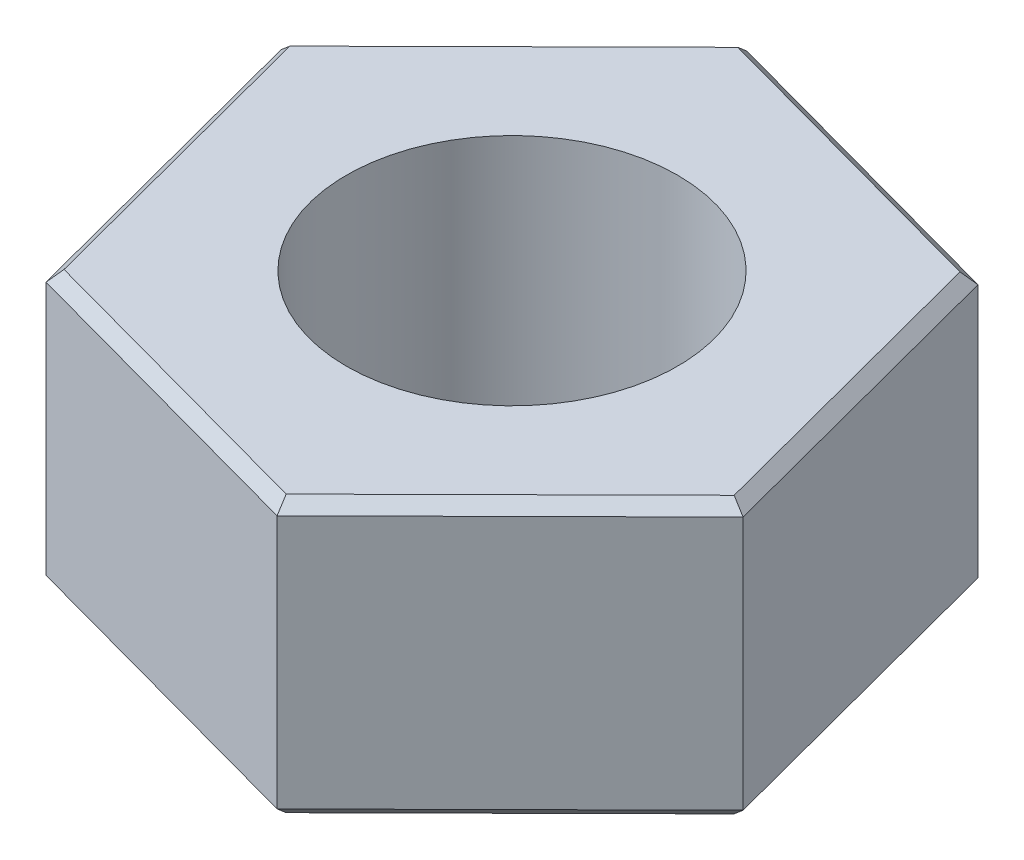
from build123d import *

# Parameters (mm, degrees)
SKETCH1_R           = 3
BOSS_EXTRUDE1_DEPTH = 5
CHAMFER2_SIZE       = 0.2


with BuildPart() as part:
    # Sketch1 → Boss-Extrude1 (new body)
    with BuildSketch(Plane(origin=(0, 0, 0), x_dir=(1, 0, 0), z_dir=(0, 1, 0))):
        Polygon((-4.241992166, -4.202035335), (1.518073264, -5.774690646), (5.760065431, -1.572655311), (4.241992166, 4.202035335), (-1.518073264, 5.774690646), (-5.760065431, 1.572655311), align=None)
        with Locations(Location((0, 0, 0), (0, 0, 270))):
            Circle(SKETCH1_R, mode=Mode.SUBTRACT)
    extrude(amount=BOSS_EXTRUDE1_DEPTH)

    # Chamfer2
    chamfer2_edges = [part.edges().sort_by_distance(p)[0] for p in [
        (3.639069348, 5, 3.673672979),
        (5.001028798, 5, -1.314690012),
        (1.361959451, 5, -4.98836299),
        (-3.639069348, 5, -3.673672979),
        (-5.001028798, 5, 1.314690012),
        (-3.639069348, 0, -3.673672979),
        (1.361959451, 0, -4.98836299),
        (5.001028798, 0, -1.314690012),
        (-1.361959451, 5, 4.98836299),
        (3.639069348, 0, 3.673672979),
        (-1.361959451, 0, 4.98836299),
        (-5.001028798, 0, 1.314690012),
    ]]
    chamfer(chamfer2_edges, length=CHAMFER2_SIZE)


solid = part.part
